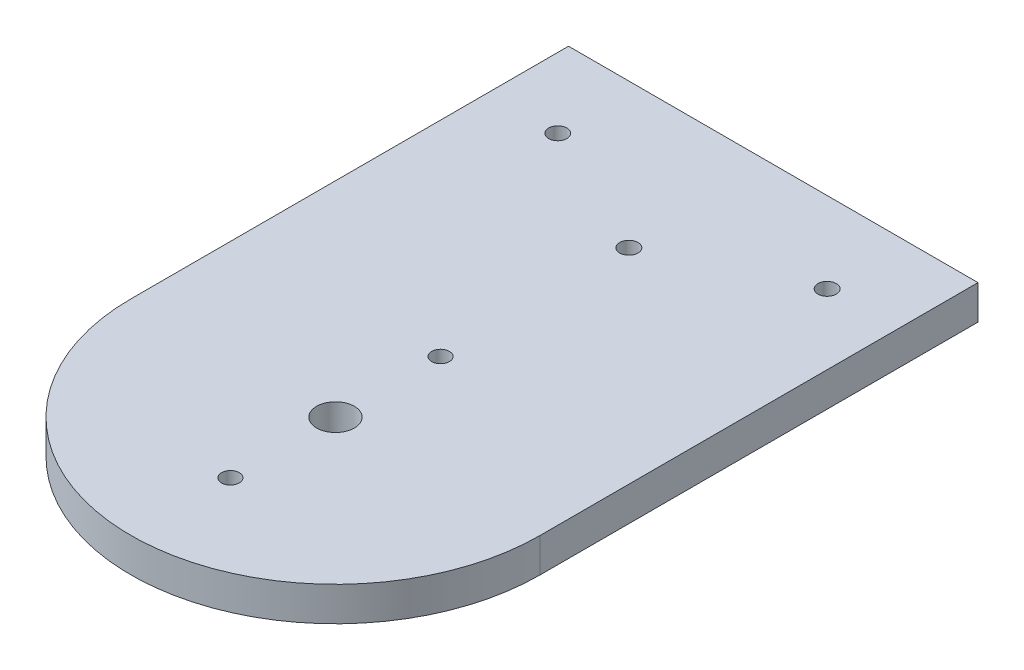
from build123d import *

# Parameters (mm, degrees)
PARED_B_CHUMACERA_J2_START          = -21.35
CROQUIS1_W                          = 76
CROQUIS1_H                          = 81.25
PARED_B_CHUMACERA_J2_DEPTH          = 6.35
PARED_B_CHUMACERA_J2_REDONDEO_START = -21.35
CROQUIS2_R                          = 38
PARED_B_CHUMACERA_J2_REDONDEO_DEPTH = 6.35
PASO_PIN_Y_ROSCA_M4_EJEFALSO_START  = -21.35
CROQUIS3_R                          = 3.5
CROQUIS3_R_2                        = 1.65
PASO_PIN_Y_ROSCA_M4_EJEFALSO_DEPTH  = 6.35
ROSCA_M3_ESCUADRAS_START            = -21.35
CROQUIS4_R                          = 1.25
ROSCA_M3_ESCUADRAS_DEPTH            = 6.35
PASADORES_D4_START                  = 90.2
CROQUIS5_R                          = 2
PASADORES_D4_DEPTH                  = 8
ROSCA_M3_BASES_CINCHO_START         = -21.35
CROQUIS6_R                          = 1.25
ROSCA_M3_BASES_CINCHO_DEPTH         = 6.35
PASO_M3_ESCUADRAS_TUERCA_START      = -21.35
CROQUIS7_R                          = 1.7
PASO_M3_ESCUADRAS_TUERCA_DEPTH      = 6.35
PASO_M3_BASE_CINCHO_TUERCA_START    = -21.35
CROQUIS8_R                          = 1.7
PASO_M3_BASE_CINCHO_TUERCA_DEPTH    = 6.35


with BuildPart() as part:
    # Croquis1 → Pared_B_chumacera_J2 (new body)
    with BuildSketch(Plane(origin=(0, 0, 0), x_dir=(1, 0, 0), z_dir=(0, 1, 0)).offset(PARED_B_CHUMACERA_J2_START)):
        with Locations((0, -130.825)):
            Rectangle(CROQUIS1_W, CROQUIS1_H)
    extrude(amount=PARED_B_CHUMACERA_J2_DEPTH)

    # Croquis2 → Pared_B_chumacera_J2_redondeo (add)
    with BuildSketch(Plane(origin=(0, 0, 0), x_dir=(1, 0, 0), z_dir=(0, 1, 0)).offset(PARED_B_CHUMACERA_J2_REDONDEO_START)):
        with Locations((0, -171.45)):
            Circle(CROQUIS2_R)
    extrude(amount=PARED_B_CHUMACERA_J2_REDONDEO_DEPTH)

    # Croquis3 → Paso_pin_y_rosca_M4_ejefalso (cut)
    with BuildSketch(Plane(origin=(0, 0, 0), x_dir=(1, 0, 0), z_dir=(0, 1, 0)).offset(PASO_PIN_Y_ROSCA_M4_EJEFALSO_START)):
        with Locations(Location((0, -171.45, 0), (0, 0, 270))):
            Circle(CROQUIS3_R)
        with Locations(Location((0, -190.95, 0), (0, 0, 270))):
            Circle(CROQUIS3_R_2)
        with Locations(Location((0, -151.95, 0), (0, 0, 270))):
            Circle(CROQUIS3_R_2)
    extrude(amount=PASO_PIN_Y_ROSCA_M4_EJEFALSO_DEPTH, mode=Mode.SUBTRACT)

    # Croquis4 → Rosca_M3_escuadras (cut)
    with BuildSketch(Plane(origin=(0, 0, 0), x_dir=(1, 0, 0), z_dir=(0, 1, 0)).offset(ROSCA_M3_ESCUADRAS_START)):
        with Locations(Location((-25, -105.2, 0), (0, 0, 270))):
            Circle(CROQUIS4_R)
        with Locations(Location((25, -105.2, 0), (0, 0, 270))):
            Circle(CROQUIS4_R)
    extrude(amount=ROSCA_M3_ESCUADRAS_DEPTH, mode=Mode.SUBTRACT)

    # Croquis5 → Pasadores_D4 (cut)
    with BuildSketch(Plane.XY.offset(PASADORES_D4_START)):
        with Locations((-30, -18.175)):
            Circle(CROQUIS5_R)
        with Locations((30, -18.175)):
            Circle(CROQUIS5_R)
    extrude(amount=PASADORES_D4_DEPTH, mode=Mode.SUBTRACT)

    # Croquis6 → Rosca_M3_bases_cincho (cut)
    with BuildSketch(Plane(origin=(0, 0, 0), x_dir=(1, 0, 0), z_dir=(0, 1, 0)).offset(ROSCA_M3_BASES_CINCHO_START)):
        with Locations(Location((0, -117, 0), (0, 0, 270))):
            Circle(CROQUIS6_R)
    extrude(amount=ROSCA_M3_BASES_CINCHO_DEPTH, mode=Mode.SUBTRACT)

    # Croquis7 → Paso_M3_escuadras_tuerca (cut)
    with BuildSketch(Plane(origin=(0, 0, 0), x_dir=(1, 0, 0), z_dir=(0, 1, 0)).offset(PASO_M3_ESCUADRAS_TUERCA_START)):
        with Locations(Location((-25, -105.2, 0), (0, 0, 270))):
            Circle(CROQUIS7_R)
        with Locations(Location((25, -105.2, 0), (0, 0, 270))):
            Circle(CROQUIS7_R)
    extrude(amount=PASO_M3_ESCUADRAS_TUERCA_DEPTH, mode=Mode.SUBTRACT)

    # Croquis8 → Paso_M3_base_cincho_tuerca (cut)
    with BuildSketch(Plane(origin=(0, 0, 0), x_dir=(1, 0, 0), z_dir=(0, 1, 0)).offset(PASO_M3_BASE_CINCHO_TUERCA_START)):
        with Locations(Location((0, -117, 0), (0, 0, 270))):
            Circle(CROQUIS8_R)
    extrude(amount=PASO_M3_BASE_CINCHO_TUERCA_DEPTH, mode=Mode.SUBTRACT)


solid = part.part
